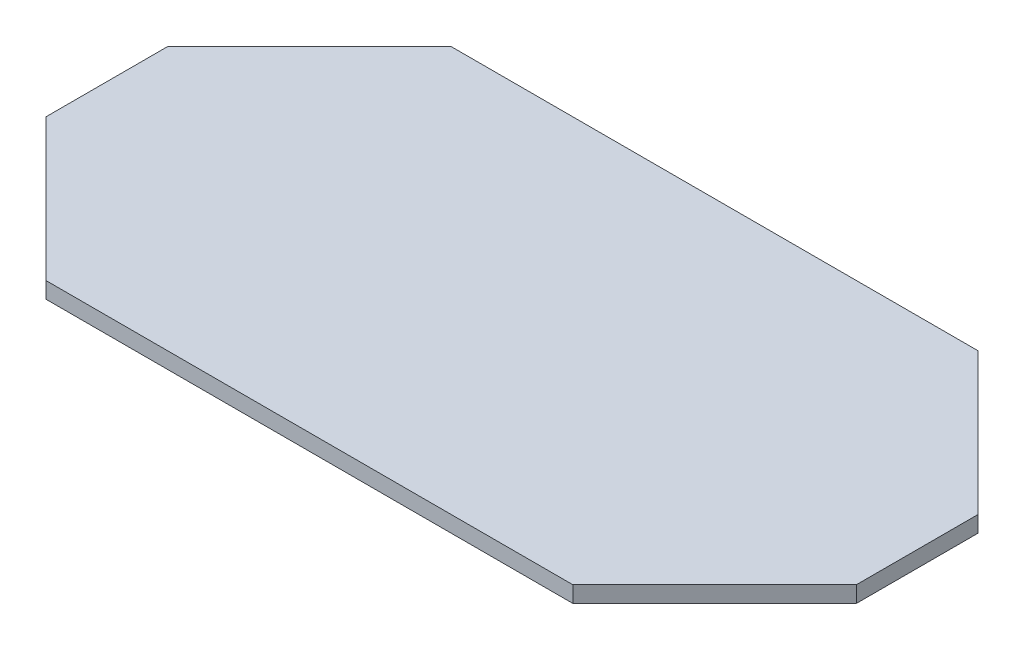
from build123d import *

# Parameters (mm, degrees)
SKETCH1_W           = 127
SKETCH1_H           = 63.5
BOSS_EXTRUDE1_DEPTH = 2.54
CHAMFER1_SIZE       = 22.225


with BuildPart() as part:
    # Sketch1 → Boss-Extrude1 (new body)
    with BuildSketch(Plane(origin=(0, 0, 0), x_dir=(1, 0, 0), z_dir=(0, 1, 0))):
        Rectangle(SKETCH1_W, SKETCH1_H)
    extrude(amount=BOSS_EXTRUDE1_DEPTH)

    # Chamfer1
    chamfer1_edges = [part.edges().sort_by_distance(p)[0] for p in [
        (-63.5, 1.27, -31.75),
        (63.5, 1.27, -31.75),
        (63.5, 1.27, 31.75),
        (-63.5, 1.27, 31.75),
    ]]
    chamfer(chamfer1_edges, length=CHAMFER1_SIZE)


solid = part.part
